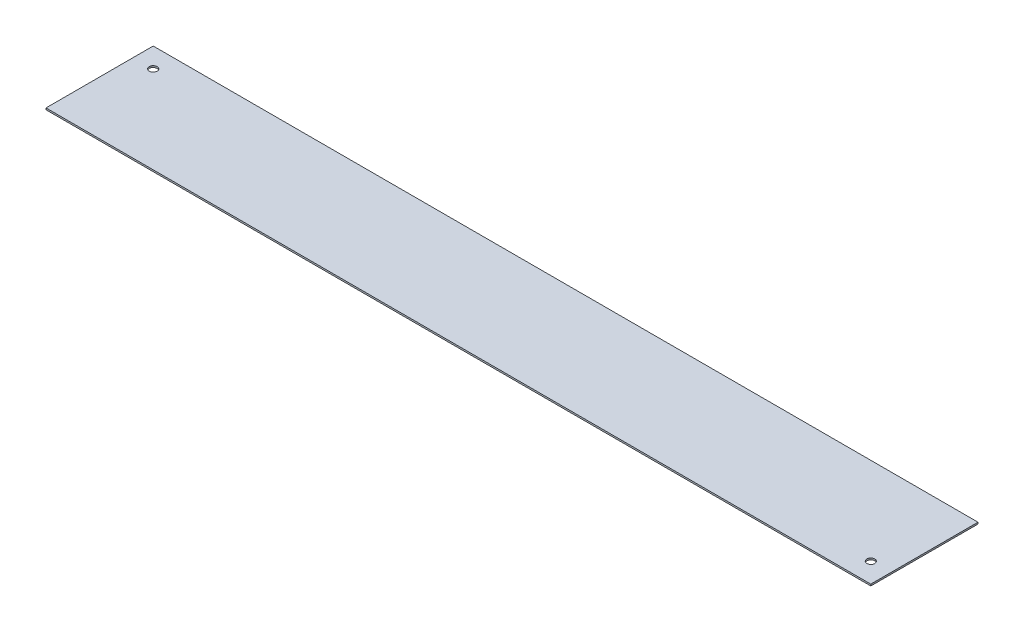
from build123d import *

# Parameters (mm, degrees)
SKETCH1_W            = 500
SKETCH1_H            = 65
BOSS_EXTRUDE1_DEPTH  = 1
M4_CLEARANCE_SLOT1_D = 4.8


with BuildPart() as part:
    # Sketch1 → Boss-Extrude1 (new body)
    with BuildSketch(Plane(origin=(0, 0, 0), x_dir=(1, 0, 0), z_dir=(0, 1, 0))):
        with Locations((-177.555066079, 2.863436123)):
            Rectangle(SKETCH1_W, SKETCH1_H)
    extrude(amount=BOSS_EXTRUDE1_DEPTH)

    # M4 Clearance Slot1 (through all)
    with Locations(Plane(origin=(0, 1, 0), x_dir=(1, 0, 0), z_dir=(0, 1, 0))):
        with Locations((-415.555066079, 23.363436123), (60.444933921, -17.636563877)):
            Hole(M4_CLEARANCE_SLOT1_D / 2)


solid = part.part
